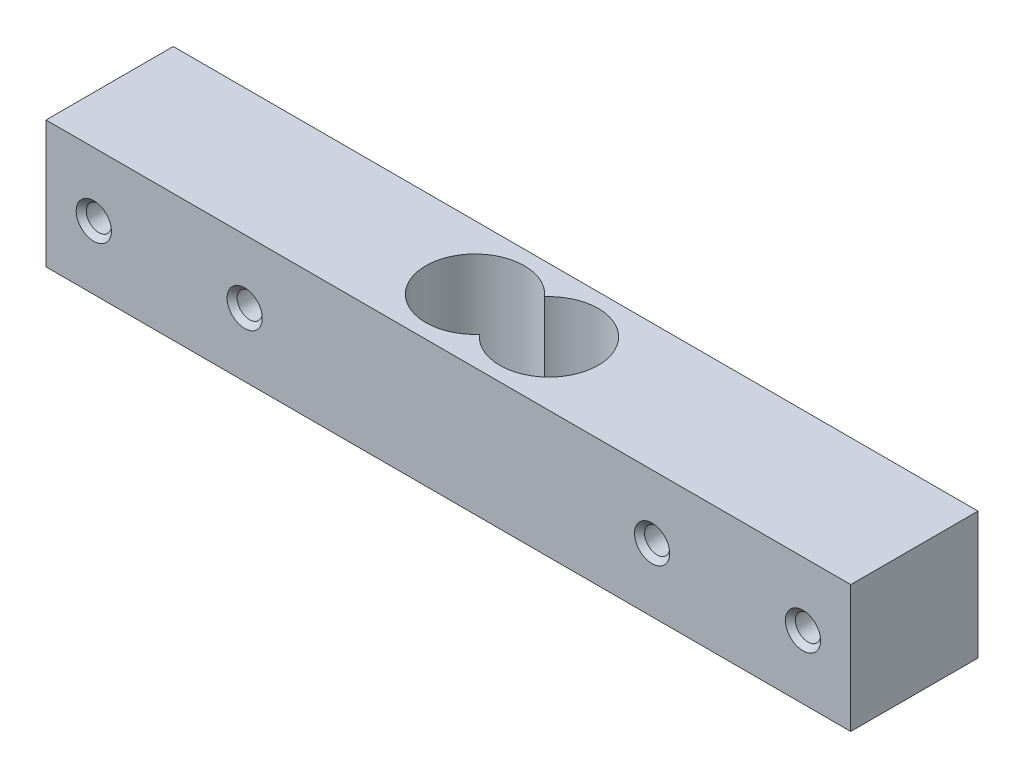
from build123d import *

# Parameters (mm, degrees)
SKETCH1_W                  = 80
SKETCH1_H                  = 12.65
BOSS_EXTRUDE1_DEPTH        = 6.325
M3_TAPPED_HOLE1_AT_2_COUNT = 2
M3_TAPPED_HOLE1_AT_2_PITCH = 15
M3_TAPPED_HOLE1_AT_3_COUNT = 2
M3_TAPPED_HOLE1_AT_3_PITCH = 55.5
M3_TAPPED_HOLE1_AT_4_COUNT = 2
M3_TAPPED_HOLE1_AT_4_PITCH = 70.5
SCALE1_SCALE               = 3


with BuildPart() as part:
    # Sketch1 → Boss-Extrude1 (new, symmetric)
    with BuildSketch(Plane(origin=(0, 0, 0), x_dir=(1, 0, 0), z_dir=(0, 1, 0))):
        Rectangle(SKETCH1_W, SKETCH1_H)
        with BuildLine():
            ThreePointArc((0, -3.241045356), (-8.575, 0), (0, 3.241045356))
            ThreePointArc((0, 3.241045356), (5.407411614, 4.583530299), (8.575, 0))
            ThreePointArc((8.575, 0), (5.407411614, -4.583530299), (0, -3.241045356))
        make_face(mode=Mode.SUBTRACT)
    extrude(amount=BOSS_EXTRUDE1_DEPTH, both=True)

    # Sketch5 → M3 Tapped Hole1 (revolve, cut)
    with BuildSketch(Plane(origin=(-35.25, 0, -6.325), x_dir=(0, 1, 0), z_dir=(1, 0, 0))):
        Polygon((0, 0), (0, 12.65), (1.75, 12.65), (1.25, 12.15), (1.25, 0.5), (1.75, 0), align=None)
    m3_tapped_hole1 = revolve(axis=Axis((-35.25, 0, -12.675), (0, 0, 1)), mode=Mode.SUBTRACT)

    # M3 Tapped Hole1 at 2: M3 Tapped Hole1 ×2
    with Locations(*[(i * M3_TAPPED_HOLE1_AT_2_PITCH, 0, 0) for i in range(1, M3_TAPPED_HOLE1_AT_2_COUNT)]):
        add(m3_tapped_hole1, mode=Mode.SUBTRACT)

    # M3 Tapped Hole1 at 3: M3 Tapped Hole1 ×2
    with Locations(*[(i * M3_TAPPED_HOLE1_AT_3_PITCH, 0, 0) for i in range(1, M3_TAPPED_HOLE1_AT_3_COUNT)]):
        add(m3_tapped_hole1, mode=Mode.SUBTRACT)

    # M3 Tapped Hole1 at 4: M3 Tapped Hole1 ×2
    with Locations(*[(i * M3_TAPPED_HOLE1_AT_4_PITCH, 0, 0) for i in range(1, M3_TAPPED_HOLE1_AT_4_COUNT)]):
        add(m3_tapped_hole1, mode=Mode.SUBTRACT)


with BuildPart() as part_1:
    # Scale1: scaled about (0, 0, 0)
    add(part.part.scale(SCALE1_SCALE))


solid = part_1.part
